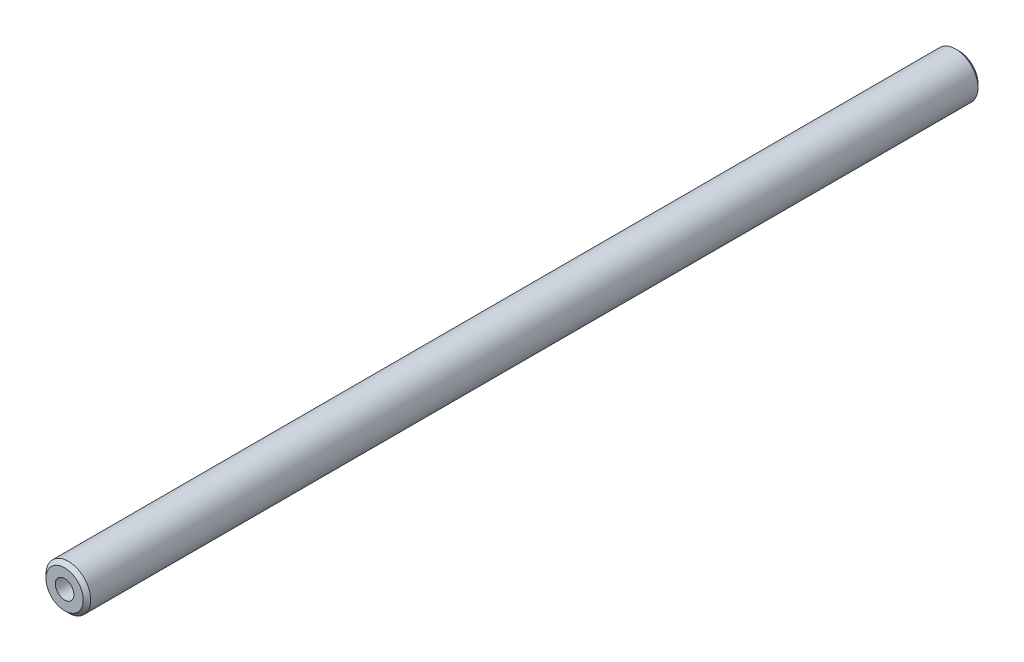
from build123d import *

# Parameters (mm, degrees)
SKETCH_1_R      = 3
EXTRUDE_1_DEPTH = 60
CHAMFER_1_SIZE  = 0.5


with BuildPart() as part:
    # ｽｹｯﾁ1 → ﾎﾞｽ - 押し出し1 (new, symmetric)
    with BuildSketch(Plane.XY):
        Circle(SKETCH_1_R)
    extrude(amount=EXTRUDE_1_DEPTH, both=True)

    # 面取り1
    chamfer_1_edges = [part.edges().sort_by_distance(p)[0] for p in [
        (-3, 0, -60),
        (-3, 0, 60),
    ]]
    chamfer(chamfer_1_edges, length=CHAMFER_1_SIZE)

    # ｽｹｯﾁ3 → M3 ねじ穴1 (revolve, cut)
    with BuildSketch(Plane(origin=(0, 0, 60), x_dir=(0, -1, 0), z_dir=(1, 0, 0))):
        Polygon((0, 0), (0, 9.251075774), (1.25, 8.5), (1.25, 0), align=None)
    hole_wizard_m3_1 = revolve(axis=Axis((0, 0, 66.35), (0, 0, -1)), mode=Mode.SUBTRACT)

    # ﾐﾗｰ1: M3 ねじ穴1 across plane
    add(hole_wizard_m3_1.mirror(Plane.XY), mode=Mode.SUBTRACT)


solid = part.part
